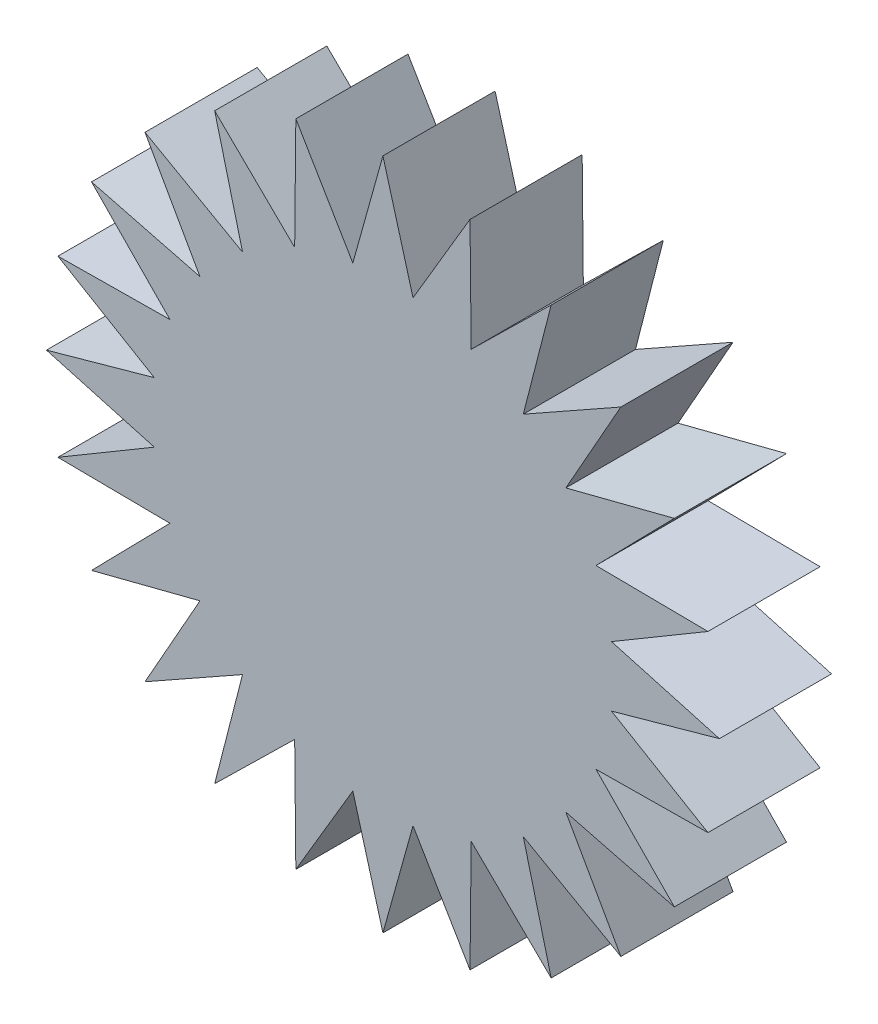
from build123d import *

# Parameters (mm, degrees)
ESQUISSE1_R             = 15
BOSS_EXTRU_1_DEPTH      = 5
ENL_V_START             = -5
ENL_V_MAT_EXTRU_1_DEPTH = 5


with BuildPart() as part:
    # Esquisse1 → Boss.-Extru.1 (new body)
    with BuildSketch(Plane.XY):
        Circle(ESQUISSE1_R)
    extrude(amount=BOSS_EXTRU_1_DEPTH)

    # Esquisse2 → Enlèv. mat.-Extru.1 (cut)
    with BuildSketch(Plane.XY.offset(5).offset(ENL_V_START)):
        with BuildLine():
            Line((-6.257363421, 8.154754778), (-7.5, 12.990381057))
            ThreePointArc((-7.5, 12.990381057), (-9.131421435, 11.900300104), (-10.606601718, 10.606601718))
            Line((-10.606601718, 10.606601718), (-6.257363421, 8.154754778))
        make_face()
        with BuildLine():
            Line((-3.933543089, 9.496413072), (-3.882285677, 14.488887394))
            ThreePointArc((-3.882285677, 14.488887394), (-5.740251485, 13.858192988), (-7.5, 12.990381057))
            Line((-7.5, 12.990381057), (-3.933543089, 9.496413072))
        make_face()
        with BuildLine():
            Line((-1.341658295, 10.19090651), (0, 15))
            ThreePointArc((0, 15), (-1.957892883, 14.871672921), (-3.882285677, 14.488887394))
            Line((-3.882285677, 14.488887394), (-1.341658295, 10.19090651))
        make_face()
        with BuildLine():
            ThreePointArc((3.882285677, 14.488887394), (1.957892883, 14.871672921), (0, 15))
            Line((0, 15), (1.341658295, 10.19090651))
            Line((1.341658295, 10.19090651), (3.882285677, 14.488887394))
        make_face()
        with BuildLine():
            ThreePointArc((7.5, 12.990381057), (5.740251485, 13.858192988), (3.882285677, 14.488887394))
            Line((3.882285677, 14.488887394), (3.933543089, 9.496413072))
            Line((3.933543089, 9.496413072), (7.5, 12.990381057))
        make_face()
        with BuildLine():
            ThreePointArc((10.606601718, 10.606601718), (9.131421435, 11.900300104), (7.5, 12.990381057))
            Line((7.5, 12.990381057), (6.257363421, 8.154754778))
            Line((6.257363421, 8.154754778), (10.606601718, 10.606601718))
        make_face()
        with BuildLine():
            ThreePointArc((12.990381057, 7.5), (11.900300104, 9.131421435), (10.606601718, 10.606601718))
            Line((10.606601718, 10.606601718), (8.154754778, 6.257363421))
            Line((8.154754778, 6.257363421), (12.990381057, 7.5))
        make_face()
        with BuildLine():
            ThreePointArc((14.488887394, 3.882285677), (13.858192988, 5.740251485), (12.990381057, 7.5))
            Line((12.990381057, 7.5), (9.496413072, 3.933543089))
            Line((9.496413072, 3.933543089), (14.488887394, 3.882285677))
        make_face()
        with BuildLine():
            ThreePointArc((15, 0), (14.871672921, 1.957892883), (14.488887394, 3.882285677))
            Line((14.488887394, 3.882285677), (10.19090651, 1.341658295))
            Line((10.19090651, 1.341658295), (15, 0))
        make_face()
        with BuildLine():
            ThreePointArc((14.488887394, -3.882285677), (14.871672921, -1.957892883), (15, 0))
            Line((15, 0), (10.19090651, -1.341658295))
            Line((10.19090651, -1.341658295), (14.488887394, -3.882285677))
        make_face()
        with BuildLine():
            ThreePointArc((12.990381057, -7.5), (13.858192988, -5.740251485), (14.488887394, -3.882285677))
            Line((14.488887394, -3.882285677), (9.496413072, -3.933543089))
            Line((9.496413072, -3.933543089), (12.990381057, -7.5))
        make_face()
        with BuildLine():
            ThreePointArc((10.606601718, -10.606601718), (11.900300104, -9.131421435), (12.990381057, -7.5))
            Line((12.990381057, -7.5), (8.154754778, -6.257363421))
            Line((8.154754778, -6.257363421), (10.606601718, -10.606601718))
        make_face()
        with BuildLine():
            ThreePointArc((7.5, -12.990381057), (9.131421435, -11.900300104), (10.606601718, -10.606601718))
            Line((10.606601718, -10.606601718), (6.257363421, -8.154754778))
            Line((6.257363421, -8.154754778), (7.5, -12.990381057))
        make_face()
        with BuildLine():
            ThreePointArc((3.882285677, -14.488887394), (5.740251485, -13.858192988), (7.5, -12.990381057))
            Line((7.5, -12.990381057), (3.933543089, -9.496413072))
            Line((3.933543089, -9.496413072), (3.882285677, -14.488887394))
        make_face()
        with BuildLine():
            ThreePointArc((0, -15), (1.957892883, -14.871672921), (3.882285677, -14.488887394))
            Line((3.882285677, -14.488887394), (1.341658295, -10.19090651))
            Line((1.341658295, -10.19090651), (0, -15))
        make_face()
        with BuildLine():
            Line((-1.341658295, -10.19090651), (-3.882285677, -14.488887394))
            ThreePointArc((-3.882285677, -14.488887394), (-1.957892883, -14.871672921), (0, -15))
            Line((0, -15), (-1.341658295, -10.19090651))
        make_face()
        with BuildLine():
            Line((-3.933543089, -9.496413072), (-7.5, -12.990381057))
            ThreePointArc((-7.5, -12.990381057), (-5.740251485, -13.858192988), (-3.882285677, -14.488887394))
            Line((-3.882285677, -14.488887394), (-3.933543089, -9.496413072))
        make_face()
        with BuildLine():
            Line((-6.257363421, -8.154754778), (-10.606601718, -10.606601718))
            ThreePointArc((-10.606601718, -10.606601718), (-9.131421435, -11.900300104), (-7.5, -12.990381057))
            Line((-7.5, -12.990381057), (-6.257363421, -8.154754778))
        make_face()
        with BuildLine():
            Line((-8.154754778, -6.257363421), (-12.990381057, -7.5))
            ThreePointArc((-12.990381057, -7.5), (-11.900300104, -9.131421435), (-10.606601718, -10.606601718))
            Line((-10.606601718, -10.606601718), (-8.154754778, -6.257363421))
        make_face()
        with BuildLine():
            Line((-9.496413072, -3.933543089), (-14.488887394, -3.882285677))
            ThreePointArc((-14.488887394, -3.882285677), (-13.858192988, -5.740251485), (-12.990381057, -7.5))
            Line((-12.990381057, -7.5), (-9.496413072, -3.933543089))
        make_face()
        with BuildLine():
            Line((-10.19090651, -1.341658295), (-15, 0))
            ThreePointArc((-15, 0), (-14.871672921, -1.957892883), (-14.488887394, -3.882285677))
            Line((-14.488887394, -3.882285677), (-10.19090651, -1.341658295))
        make_face()
        with BuildLine():
            Line((-10.19090651, 1.341658295), (-14.488887394, 3.882285677))
            ThreePointArc((-14.488887394, 3.882285677), (-14.871672921, 1.957892883), (-15, 0))
            Line((-15, 0), (-10.19090651, 1.341658295))
        make_face()
        with BuildLine():
            Line((-9.496413072, 3.933543089), (-12.990381057, 7.5))
            ThreePointArc((-12.990381057, 7.5), (-13.858192988, 5.740251485), (-14.488887394, 3.882285677))
            Line((-14.488887394, 3.882285677), (-9.496413072, 3.933543089))
        make_face()
        with BuildLine():
            Line((-8.154754778, 6.257363421), (-10.606601718, 10.606601718))
            ThreePointArc((-10.606601718, 10.606601718), (-11.900300104, 9.131421435), (-12.990381057, 7.5))
            Line((-12.990381057, 7.5), (-8.154754778, 6.257363421))
        make_face()
    extrude(amount=ENL_V_MAT_EXTRU_1_DEPTH, mode=Mode.SUBTRACT)


solid = part.part
